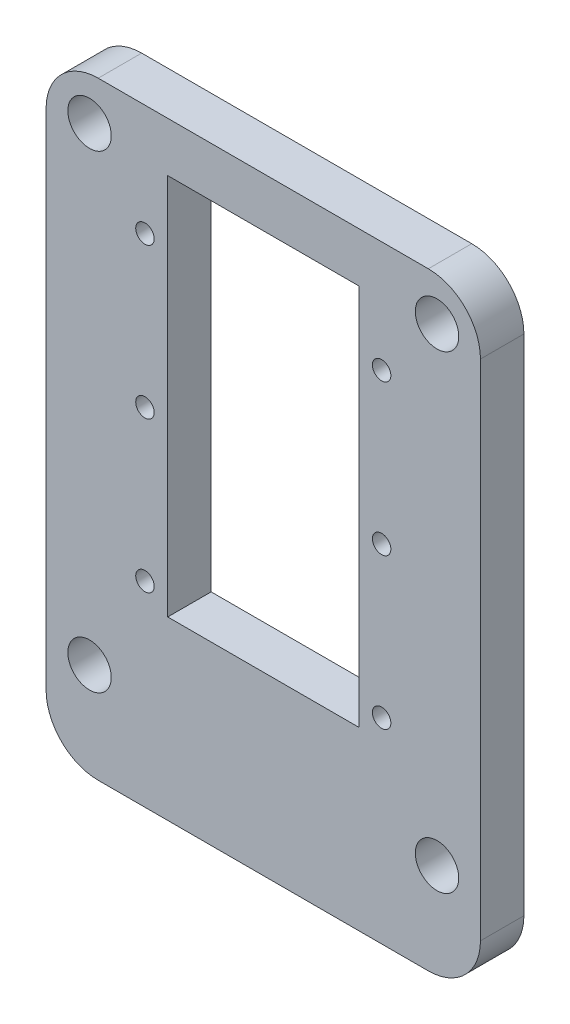
from build123d import *

# Parameters (mm, degrees)
BOSS_EXTRUDE1_DEPTH = 6.35
SKETCH2_R           = 1.35
SKETCH2_R_2         = 1.385
CUT_EXTRUDE1_DEPTH  = 38.116505762
SKETCH3_W           = 63.5
SKETCH3_H           = 88.9
SKETCH3_W_2         = 38.321076004
SKETCH3_H_2         = 47.237540142
BOSS_EXTRUDE2_DEPTH = 6.35
SKETCH5_W           = 27.94
SKETCH5_H           = 55.88
CUT_EXTRUDE3_DEPTH  = 61.153053743
SKETCH6_R           = 3.175
CUT_EXTRUDE4_DEPTH  = 61.153053743
FILLET2_R           = 7.62


with BuildPart() as part:
    # Sketch1 → Boss-Extrude1 (new body)
    with BuildSketch(Plane.XY):
        with BuildLine():
            Line((-19.69889026, 23.2987845), (-14.850045261, 29.75147823))
            ThreePointArc((-14.850045261, 29.75147823), (-14.144755454, 30.339267512), (-13.251155001, 30.55))
            Line((-13.251155001, 30.55), (13.251155001, 30.55))
            ThreePointArc((13.251155001, 30.55), (14.144755454, 30.339267512), (14.850045261, 29.75147823))
            Line((14.850045261, 29.75147823), (19.69889026, 23.2987845))
            ThreePointArc((19.69889026, 23.2987845), (19.997074131, 22.730638521), (20.1, 22.09730627))
            Line((20.1, 22.09730627), (20.1, -22.09730627))
            ThreePointArc((20.1, -22.09730627), (19.997074131, -22.730638521), (19.69889026, -23.2987845))
            Line((19.69889026, -23.2987845), (14.850045261, -29.75147823))
            ThreePointArc((14.850045261, -29.75147823), (14.144755454, -30.339267512), (13.251155001, -30.55))
            Line((13.251155001, -30.55), (-13.251155001, -30.55))
            ThreePointArc((-13.251155001, -30.55), (-14.144755454, -30.339267512), (-14.850045261, -29.75147823))
            Line((-14.850045261, -29.75147823), (-19.69889026, -23.2987845))
            ThreePointArc((-19.69889026, -23.2987845), (-19.997074131, -22.730638521), (-20.1, -22.09730627))
            Line((-20.1, -22.09730627), (-20.1, 22.09730627))
            ThreePointArc((-20.1, 22.09730627), (-19.997074131, 22.730638521), (-19.69889026, 23.2987845))
        make_face()
    extrude(amount=-BOSS_EXTRUDE1_DEPTH)

    # Sketch2 → Cut-Extrude1 (cut, through all)
    with BuildSketch(Plane(origin=(0, 0, -6.35), x_dir=(-1, 0, 0), z_dir=(0, 0, -1))):
        with Locations((17.3, 21.9487845)):
            Circle(SKETCH2_R)
        with Locations((17.3, -0.0512155)):
            Circle(SKETCH2_R)
        with Locations((17.3, -22.0512155)):
            Circle(SKETCH2_R)
        with Locations((11, -27.75)):
            Circle(SKETCH2_R_2)
        with Locations(Location((-11, -27.75, 0), (0, 0, 180))):
            Circle(SKETCH2_R_2)
        with Locations(Location((-17.3, -22.0512155, 0), (0, 0, 180))):
            Circle(SKETCH2_R)
        with Locations(Location((-17.3, -0.0512155, 0), (0, 0, 180))):
            Circle(SKETCH2_R)
        with Locations(Location((-17.3, 21.9487845, 0), (0, 0, 180))):
            Circle(SKETCH2_R)
    extrude(amount=-CUT_EXTRUDE1_DEPTH, mode=Mode.SUBTRACT)

    # Sketch3 → Boss-Extrude2 (add)
    with BuildSketch(Plane(origin=(0, 0, -6.35), x_dir=(-1, 0, 0), z_dir=(0, 0, -1))):
        with Locations((0, -6.2452155)):
            Rectangle(SKETCH3_W, SKETCH3_H)
        Rectangle(SKETCH3_W_2, SKETCH3_H_2, mode=Mode.SUBTRACT)
    extrude(amount=-BOSS_EXTRUDE2_DEPTH)

    # Sketch5 → Cut-Extrude3 (cut, through all)
    with BuildSketch(Plane.XY):
        with Locations((0, 3.0087845)):
            Rectangle(SKETCH5_W, SKETCH5_H)
    extrude(amount=-CUT_EXTRUDE3_DEPTH, mode=Mode.SUBTRACT)

    # Sketch6 → Cut-Extrude4 (cut, through all)
    with BuildSketch(Plane(origin=(0, 0, -6.35), x_dir=(-1, 0, 0), z_dir=(0, 0, -1))):
        with Locations((25.4, 31.8547845)):
            Circle(SKETCH6_R)
        with Locations((-25.4, 31.8547845)):
            Circle(SKETCH6_R)
        with Locations((-25.4, -36.7252155)):
            Circle(SKETCH6_R)
        with Locations((25.4, -36.7252155)):
            Circle(SKETCH6_R)
    extrude(amount=-CUT_EXTRUDE4_DEPTH, mode=Mode.SUBTRACT)

    # Fillet2
    fillet2_edges = [part.edges().sort_by_distance(p)[0] for p in [
        (-31.75, 38.2047845, -3.175),
        (-31.75, -50.6952155, -3.175),
        (31.75, -50.6952155, -3.175),
        (31.75, 38.2047845, -3.175),
    ]]
    fillet(fillet2_edges, radius=FILLET2_R)


solid = part.part
